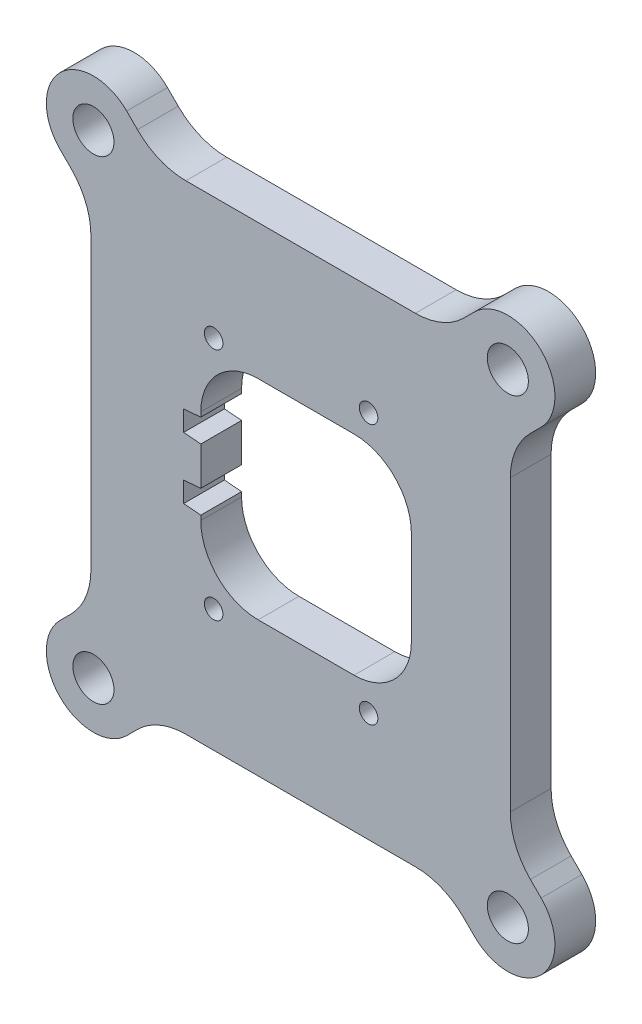
from build123d import *

# Parameters (mm, degrees)
BOSS_EXTRUDE1_DEPTH  = 4.7625
M4_CLEARANCE_HOLE1_D = 4.8
SKETCH5_R            = 1.085
CUT_EXTRUDE1_DEPTH   = 45.811860093


with BuildPart() as part:
    # Sketch1 → Boss-Extrude1 (new body)
    with BuildSketch(Plane.XY):
        with BuildLine():
            Line((-20.319587173, -31.597761766), (-19.064971157, -30.343145751))
            ThreePointArc((-19.064971157, -30.343145751), (-16.469584367, -28.60896374), (-13.408116908, -28))
            Line((-13.408116908, -28), (13.408116908, -28))
            ThreePointArc((13.408116908, -28), (16.469584367, -28.60896374), (19.064971157, -30.343145751))
            Line((19.064971157, -30.343145751), (20.319587173, -31.597761766))
            ThreePointArc((20.319587173, -31.597761766), (28.097761766, -31.597761766), (28.097761766, -23.819587173))
            Line((28.097761766, -23.819587173), (26.843145751, -22.564971157))
            ThreePointArc((26.843145751, -22.564971157), (25.10896374, -19.969584367), (24.5, -16.908116908))
            Line((24.5, -16.908116908), (24.5, 16.908116908))
            ThreePointArc((24.5, 16.908116908), (25.10896374, 19.969584367), (26.843145751, 22.564971157))
            Line((26.843145751, 22.564971157), (28.097761766, 23.819587173))
            ThreePointArc((28.097761766, 23.819587173), (28.097761766, 31.597761766), (20.319587173, 31.597761766))
            Line((20.319587173, 31.597761766), (19.064971157, 30.343145751))
            ThreePointArc((19.064971157, 30.343145751), (16.469584367, 28.60896374), (13.408116908, 28))
            Line((13.408116908, 28), (-13.408116908, 28))
            ThreePointArc((-13.408116908, 28), (-16.469584367, 28.60896374), (-19.064971157, 30.343145751))
            Line((-19.064971157, 30.343145751), (-20.319587173, 31.597761766))
            ThreePointArc((-20.319587173, 31.597761766), (-28.097761766, 31.597761766), (-28.097761766, 23.819587173))
            Line((-28.097761766, 23.819587173), (-26.843145751, 22.564971157))
            ThreePointArc((-26.843145751, 22.564971157), (-25.10896374, 19.969584367), (-24.5, 16.908116908))
            Line((-24.5, 16.908116908), (-24.5, -16.908116908))
            ThreePointArc((-24.5, -16.908116908), (-25.10896374, -19.969584367), (-26.843145751, -22.564971157))
            Line((-26.843145751, -22.564971157), (-28.097761766, -23.819587173))
            ThreePointArc((-28.097761766, -23.819587173), (-28.097761766, -31.597761766), (-20.319587173, -31.597761766))
        make_face()
    extrude(amount=BOSS_EXTRUDE1_DEPTH)

    # M4 Clearance Hole1 (through all)
    with Locations(Plane.XY.offset(4.7625)):
        with Locations((-24.20867447, 27.70867447), (24.20867447, 27.70867447), (24.20867447, -27.70867447), (-24.20867447, -27.70867447)):
            Hole(M4_CLEARANCE_HOLE1_D / 2)

    # Sketch5 → Cut-Extrude1 (cut, through all)
    with BuildSketch(Plane.XY.offset(4.7625)):
        with BuildLine():
            Line((-13.66148, -4.78318826), (-11.66148, -4.958165587))
            Line((-11.66148, -4.958165587), (-11.66148, -5.5))
            ThreePointArc((-11.66148, -5.5), (-9.699095434, -10.237615434), (-4.96148, -12.2))
            Line((-4.96148, -12.2), (6.23852, -12.2))
            ThreePointArc((6.23852, -12.2), (10.976135434, -10.237615434), (12.93852, -5.5))
            Line((12.93852, -5.5), (12.93852, 5.5))
            ThreePointArc((12.93852, 5.5), (10.976135434, 10.237615434), (6.23852, 12.2))
            Line((6.23852, 12.2), (-4.96148, 12.2))
            ThreePointArc((-4.96148, 12.2), (-9.699095434, 10.237615434), (-11.66148, 5.5))
            Line((-11.66148, 5.5), (-11.66148, 4.958165587))
            Line((-11.66148, 4.958165587), (-13.66148, 4.78318826))
            Line((-13.66148, 4.78318826), (-13.66148, 2.41681174))
            Line((-13.66148, 2.41681174), (-11.66148, 2.241834413))
            Line((-11.66148, 2.241834413), (-11.66148, -2.241834413))
            Line((-11.66148, -2.241834413), (-13.66148, -2.41681174))
            Line((-13.66148, -2.41681174), (-13.66148, -4.78318826))
        make_face()
        with Locations((-10.16148, -13.7)):
            Circle(SKETCH5_R)
        with Locations((-10.16148, 13.7)):
            Circle(SKETCH5_R)
        with Locations((7.93852, 15.2)):
            Circle(SKETCH5_R)
        with Locations((7.93852, -15.2)):
            Circle(SKETCH5_R)
    extrude(amount=-CUT_EXTRUDE1_DEPTH, mode=Mode.SUBTRACT)


solid = part.part
